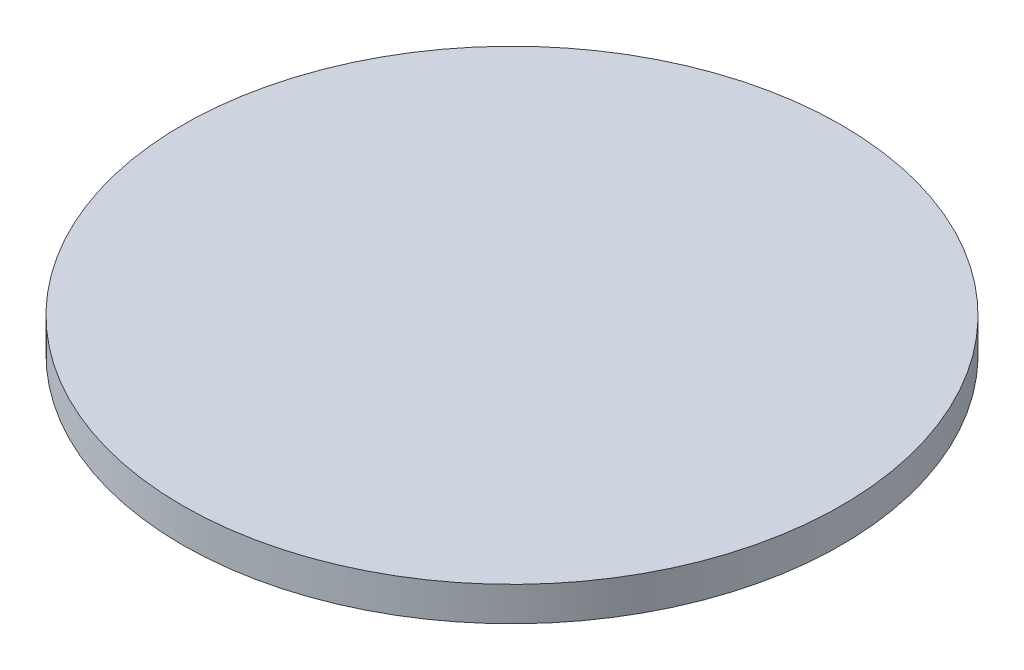
from build123d import *

# Parameters (mm, degrees)
SKETCH1_R           = 22.21
BOSS_EXTRUDE1_DEPTH = 2.3


with BuildPart() as part:
    # Sketch1 → Boss-Extrude1 (new body)
    with BuildSketch(Plane(origin=(0, 0, 0), x_dir=(1, 0, 0), z_dir=(0, 1, 0))):
        with Locations(Location((0, 0, 0), (0, 0, 270))):
            Circle(SKETCH1_R)
    extrude(amount=BOSS_EXTRUDE1_DEPTH)


solid = part.part
